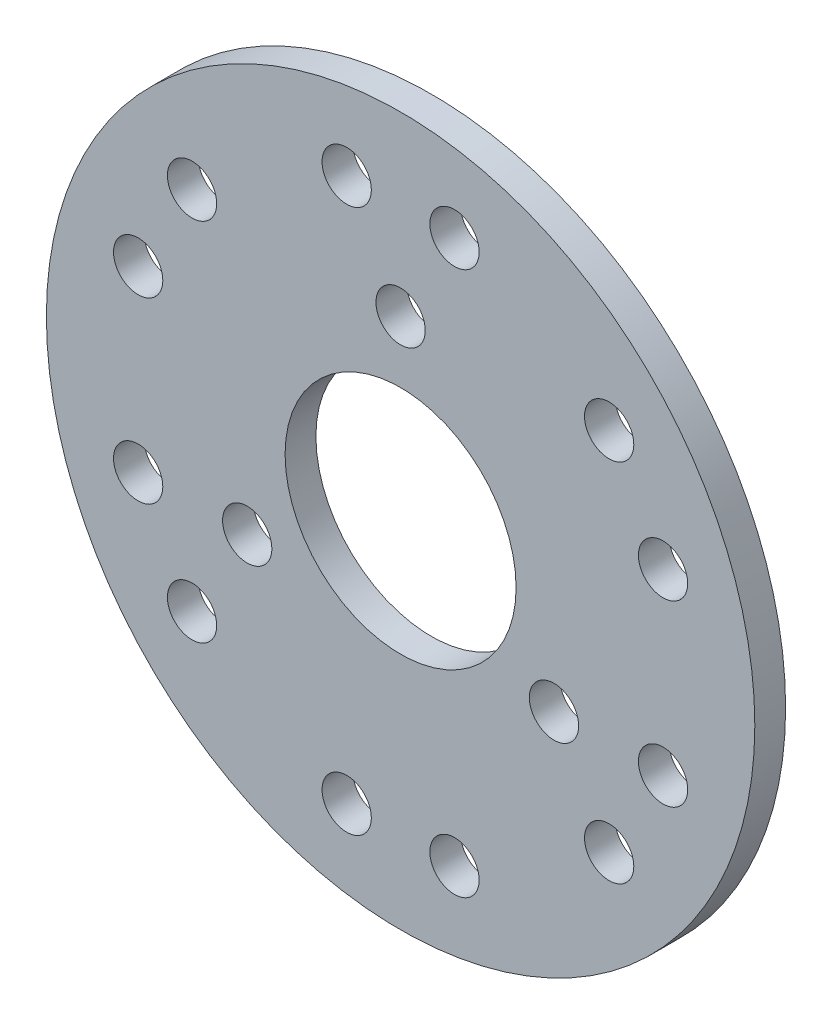
from build123d import *

# Parameters (mm, degrees)
SKETCH_1_R          = 23
EXTRUDE_1_DEPTH     = 2
SKETCH_2_R          = 1.6
SKETCH_2_R_2        = 7.5
CUT_EXTRUDE_1_DEPTH = 33.588341474


with BuildPart() as part:
    # ｽｹｯﾁ1 → ﾎﾞｽ - 押し出し1 (new body)
    with BuildSketch(Plane.XY):
        Circle(SKETCH_1_R)
    extrude(amount=EXTRUDE_1_DEPTH)

    # ｽｹｯﾁ2 → ｶｯﾄ - 押し出し1 (cut, through all)
    with BuildSketch(Plane.XY.offset(2)):
        with Locations((-3.5, 17.656443583)):
            Circle(SKETCH_2_R)
        with Locations((3.5, 17.656443583)):
            Circle(SKETCH_2_R)
        with Locations((13.540928683, 11.859310705)):
            Circle(SKETCH_2_R)
        with Locations((17.040928683, 5.797132878)):
            Circle(SKETCH_2_R)
        with Locations((17.040928683, -5.797132878)):
            Circle(SKETCH_2_R)
        with Locations((13.540928683, -11.859310705)):
            Circle(SKETCH_2_R)
        with Locations((3.5, -17.656443583)):
            Circle(SKETCH_2_R)
        with Locations((-3.5, -17.656443583)):
            Circle(SKETCH_2_R)
        with Locations((-13.540928683, -11.859310705)):
            Circle(SKETCH_2_R)
        with Locations((-17.040928683, -5.797132878)):
            Circle(SKETCH_2_R)
        with Locations((-17.040928683, 5.797132878)):
            Circle(SKETCH_2_R)
        with Locations((-13.540928683, 11.859310705)):
            Circle(SKETCH_2_R)
        Circle(SKETCH_2_R_2)
        with Locations((0, 11.5)):
            Circle(SKETCH_2_R)
        with Locations((-9.959292144, -5.75)):
            Circle(SKETCH_2_R)
        with Locations((9.959292144, -5.75)):
            Circle(SKETCH_2_R)
    extrude(amount=-CUT_EXTRUDE_1_DEPTH, mode=Mode.SUBTRACT)


solid = part.part
